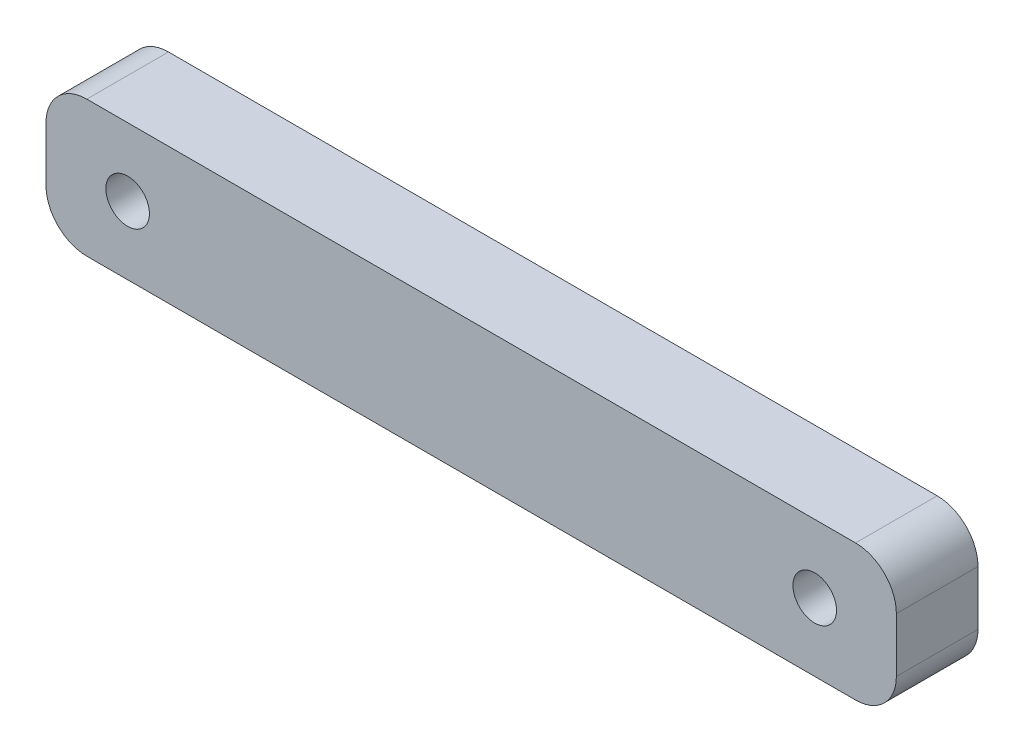
from build123d import *

# Parameters (mm, degrees)
SKETCH1_W           = 62.5
SKETCH1_H           = 10
BOSS_EXTRUDE1_DEPTH = 6
SKETCH2_R           = 1.6
CUT_EXTRUDE1_DEPTH  = 64.578691399
FILLET1_R           = 3


with BuildPart() as part:
    # Sketch1 → Boss-Extrude1 (new body)
    with BuildSketch(Plane.XY):
        with Locations((31.25, -5)):
            Rectangle(SKETCH1_W, SKETCH1_H)
    extrude(amount=BOSS_EXTRUDE1_DEPTH)

    # Sketch2 → Cut-Extrude1 (cut, through all)
    with BuildSketch(Plane.XY.offset(6)):
        with Locations((56.5, -5)):
            Circle(SKETCH2_R)
        with Locations((6, -5)):
            Circle(SKETCH2_R)
    extrude(amount=-CUT_EXTRUDE1_DEPTH, mode=Mode.SUBTRACT)

    # Fillet1
    fillet1_edges = [part.edges().sort_by_distance(p)[0] for p in [
        (0, 0, 3),
        (62.5, 0, 3),
        (62.5, -10, 3),
        (0, -10, 3),
    ]]
    fillet(fillet1_edges, radius=FILLET1_R)


solid = part.part
